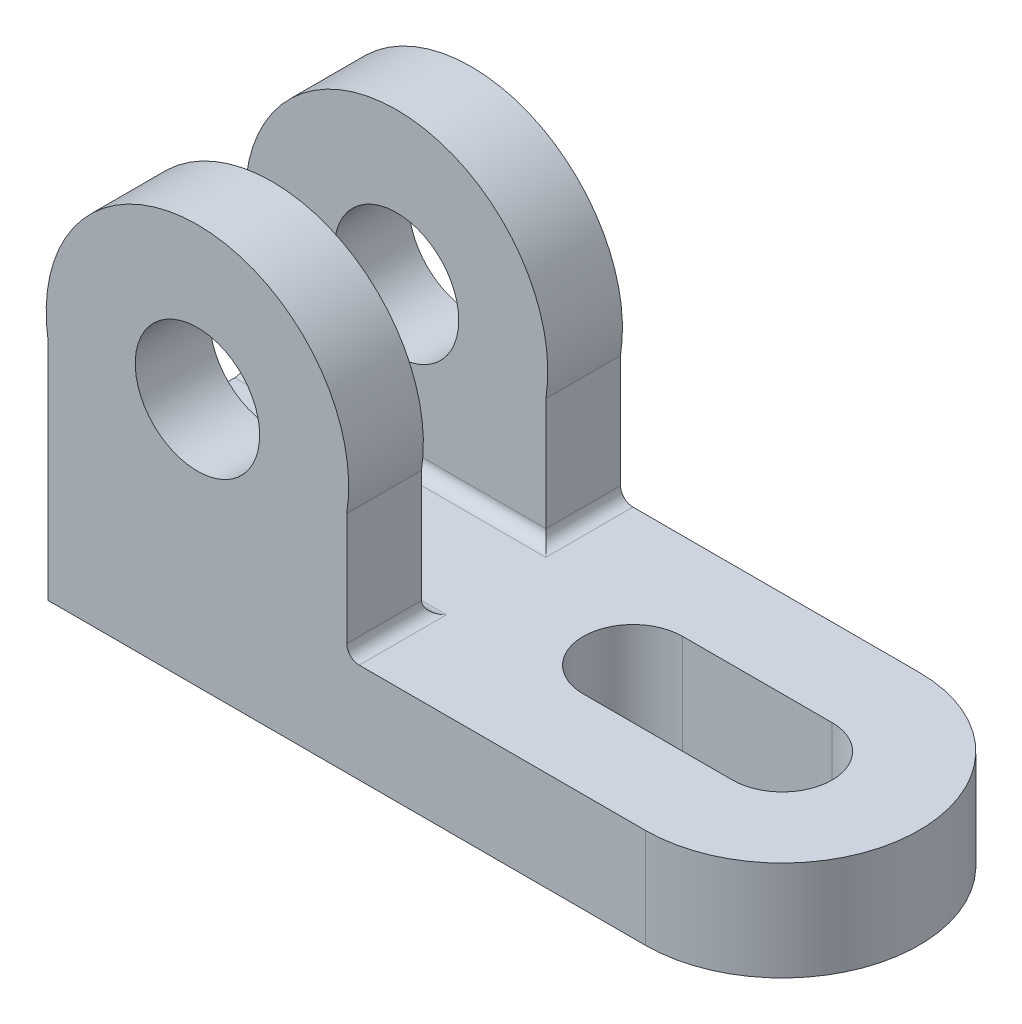
from build123d import *

# Parameters (mm, degrees)
BOSS_EXTRUDE1_DEPTH = 16
CUT_EXTRUDE1_DEPTH  = 16
SKETCH5_R           = 10
BOSS_EXTRUDE2_DEPTH = 12
FILLET1_R           = 2


with BuildPart() as part:
    # Sketch2 → Boss-Extrude1 (new body)
    with BuildSketch(Plane(origin=(0, 0, 0), x_dir=(1, 0, 0), z_dir=(0, 1, 0))):
        with BuildLine():
            Line((37, 22), (-59, 22))
            Line((-59, 22), (-59, -22))
            Line((-59, -22), (37, -22))
            ThreePointArc((37, -22), (59, 0), (37, 22))
        make_face()
    extrude(amount=BOSS_EXTRUDE1_DEPTH)

    # Sketch3 → Cut-Extrude1 (cut)
    with BuildSketch(Plane(origin=(0, 16, 0), x_dir=(1, 0, 0), z_dir=(0, 1, 0))):
        with BuildLine():
            Line((37, -8), (13, -8))
            ThreePointArc((13, -8), (5, 0), (13, 8))
            Line((13, 8), (37, 8))
            ThreePointArc((37, 8), (45, 0), (37, -8))
        make_face()
    extrude(amount=-CUT_EXTRUDE1_DEPTH, mode=Mode.SUBTRACT)

    # Sketch5 → Boss-Extrude2 (add)
    with BuildSketch(Plane.XY.offset(22)):
        with BuildLine():
            Line((-59, 16), (-11, 16))
            Line((-11, 16), (-11, 36.094530012))
            ThreePointArc((-11, 36.094530012), (-35, 64.315688266), (-59, 36.094530012))
            Line((-59, 36.094530012), (-59, 16))
        make_face()
        with Locations((-35, 40)):
            Circle(SKETCH5_R, mode=Mode.SUBTRACT)
    boss_extrude2 = extrude(amount=-BOSS_EXTRUDE2_DEPTH)

    # Mirror1: Boss-Extrude2 across plane
    add(boss_extrude2.mirror(Plane.XY))

    # Fillet1
    fillet1_edges = [part.edges().sort_by_distance(p)[0] for p in [
        (-11, 16, 16),
        (-35, 16, 10),
        (-35, 16, -10),
        (-11, 16, -16),
    ]]
    fillet(fillet1_edges, radius=FILLET1_R)


solid = part.part
